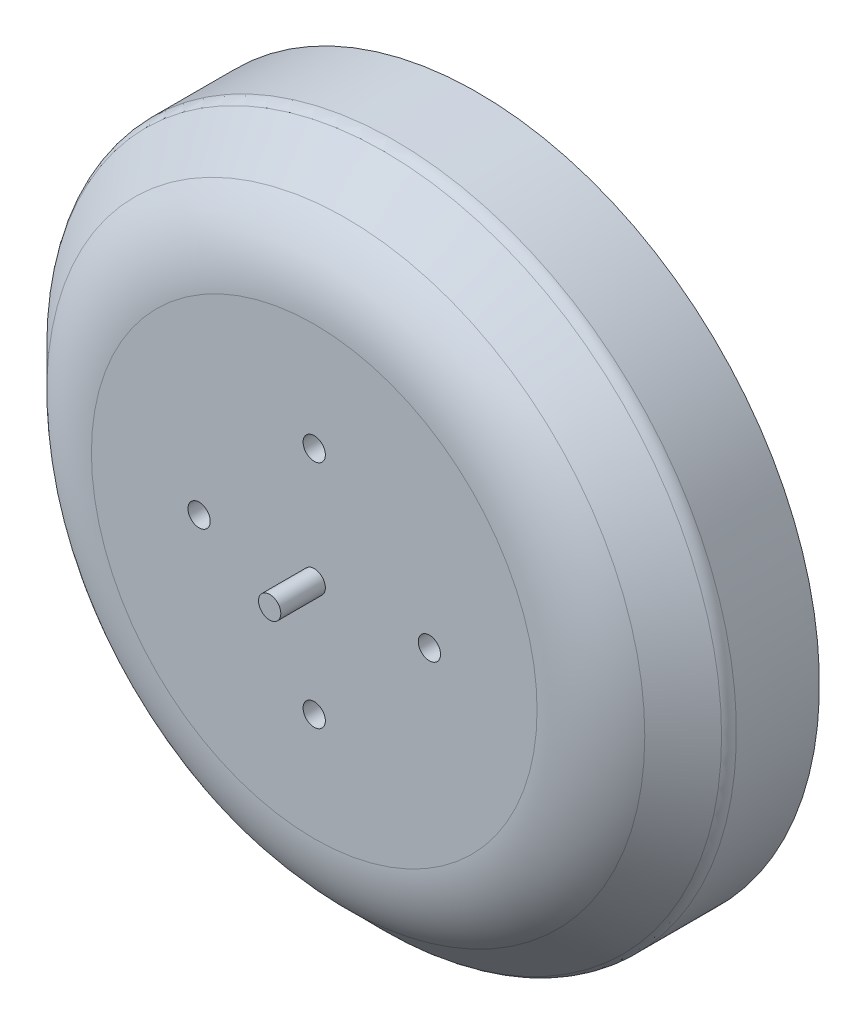
from build123d import *

# Parameters (mm, degrees)
BOSS_EXTRUDE1_DEPTH          = 4
SKETCH3_R                    = 1.5
BOSS_EXTRUDE2_DEPTH          = 6
F_3_0_3_DIAMETER_HOLE1_D     = 3
F_3_0_3_DIAMETER_HOLE1_DEPTH = 10
FILLET2_R                    = 14.5
FILLET3_R                    = 2
CUT_EXTRUDE1_DEPTH           = 74.871510978
CUT_EXTRUDE1_DEPTH_BACK      = 7
SKETCH8_R                    = 46
SKETCH8_R_2                  = 9.814954576


with BuildPart() as part:
    # Sketch1 → Revolve1 (revolve)
    with BuildSketch(Plane(origin=(0, 0, 0), x_dir=(1, 0, 0), z_dir=(0, 1, 0))):
        Polygon((28, 45.5), (0, 45.5), (0, 16.5), (36, 16.5), (46, 26.5), (46, 40.5), align=None)
    revolve(axis=Axis((0, 0, -45.5), (0, 0, 1)))

    # Sketch2 → Boss-Extrude1 (add)
    with BuildSketch(Plane(origin=(0, 0, -45.5), x_dir=(-1, 0, 0), z_dir=(0, 0, -1))):
        Polygon((-9.814954576, 0), (-4.907477288, 8.5), (4.907477288, 8.5), (9.814954576, 0), (4.907477288, -8.5), (-4.907477288, -8.5), align=None)
    extrude(amount=BOSS_EXTRUDE1_DEPTH)

    # Sketch3 → Boss-Extrude2 (add)
    with BuildSketch(Plane.XY.offset(-16.5)):
        Circle(SKETCH3_R)
    extrude(amount=BOSS_EXTRUDE2_DEPTH)

    # Ø3.0 (3) Diameter Hole1
    with Locations(Plane.XY.offset(-16.5)):
        with Locations((-15.5, 0), (0, 15.5), (0, -15.5), (15.5, 0)):
            Hole(F_3_0_3_DIAMETER_HOLE1_D / 2, depth=F_3_0_3_DIAMETER_HOLE1_DEPTH)

    # Fillet2
    fillet2_edges = [part.edges().sort_by_distance(p)[0] for p in [
        (-36, 0, -16.5),
    ]]
    fillet(fillet2_edges, radius=FILLET2_R)

    # Fillet3
    fillet3_edges = [part.edges().sort_by_distance(p)[0] for p in [
        (-46, 0, -26.5),
    ]]
    fillet(fillet3_edges, radius=FILLET3_R)

    # Sketch8 → Cut-Extrude1 (cut, two sides: drawn at the far end of the back side and taken through both)
    with BuildSketch(Plane(origin=(0, 0, -45.5), x_dir=(-1, 0, 0), z_dir=(0, 0, -1)).offset(-CUT_EXTRUDE1_DEPTH_BACK)):
        Circle(SKETCH8_R)
        Circle(SKETCH8_R_2, mode=Mode.SUBTRACT)
    extrude(amount=CUT_EXTRUDE1_DEPTH + CUT_EXTRUDE1_DEPTH_BACK, mode=Mode.SUBTRACT)


solid = part.part
